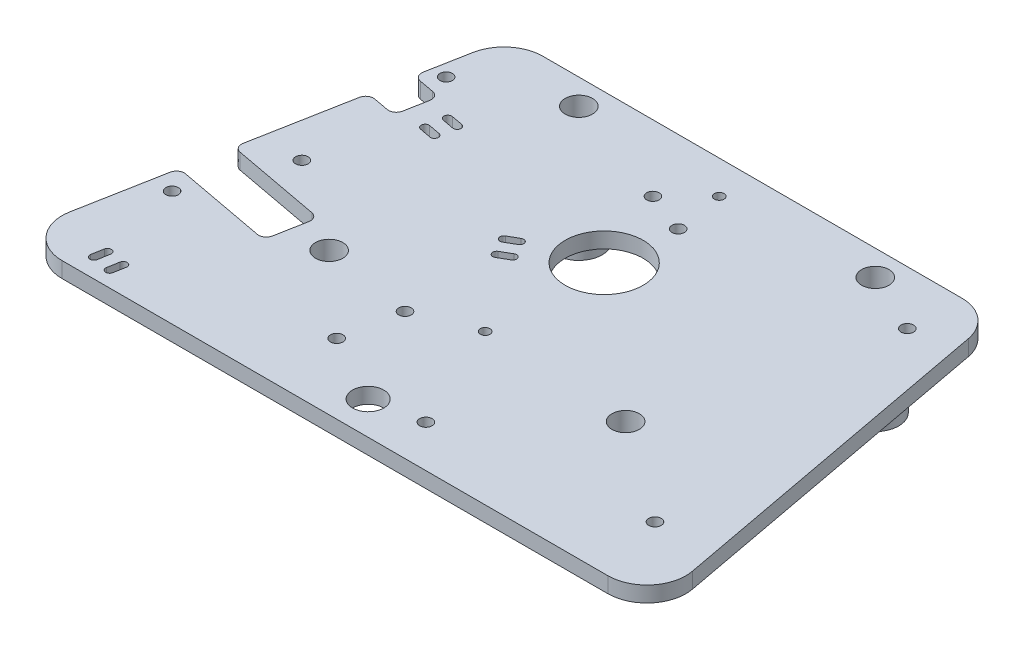
from build123d import *

# Parameters (mm, degrees)
ESQUISSE1_W              = 124
ESQUISSE1_H              = 107
BOSS_EXTRU_1_DEPTH       = 4
ESQUISSE3_R              = 6
BOSS_EXTRU_4_DEPTH       = 26
ENL_V_MAT_EXTRU_2_REACH  = 89.214
ESQUISSE4_R              = 10
BOSS_EXTRU_5_DEPTH       = 4
ESQUISSE2_R              = 1.6
ENL_V_MAT_EXTRU_1_DEPTH  = 103.40239255
ESQUISSE6_R              = 1.6
ENL_V_MAT_EXTRU_3_DEPTH  = 103.40239255
CONG_1_R                 = 10
ESQUISSE7_R              = 3.5
ENL_V_MAT_EXTRU_4_DEPTH  = 27
ESQUISSE8_R              = 1.7
ENL_V_MAT_EXTRU_5_DEPTH  = 101.774383085
ENL_V_MAT_EXTRU_6_REACH  = 101.657
CONG_2_R                 = 2
ESQUISSE10_R             = 3.5
BOSS_EXTRU_6_DEPTH       = 5
ENL_V_MAT_EXTRU_8_REACH  = 102.774
ESQUISSE11_R             = 1.25
ENL_V_MAT_EXTRU_9_REACH  = 102.774
ESQUISSE12_R             = 4
ENL_V_MAT_EXTRU_10_REACH = 102.774
CONG_3_R                 = 2
ENL_V_MAT_EXTRU_11_REACH = 102.774
ENL_V_MAT_EXTRU_12_REACH = 102.774
ENL_V_MAT_EXTRU_13_REACH = 102.774
ESQUISSE16_R             = 1.6
ENL_V_MAT_EXTRU_14_REACH = 102.774


with BuildPart() as part:
    # Esquisse1 → Boss.-Extru.1 (new body)
    with BuildSketch(Plane(origin=(0, 0, 0), x_dir=(1, 0, 0), z_dir=(0, 1, 0))):
        Rectangle(ESQUISSE1_W, ESQUISSE1_H)
    extrude(amount=BOSS_EXTRU_1_DEPTH)

    # Esquisse3 → Boss.-Extru.4 (add)
    with BuildSketch(Plane(origin=(0, 0, 0), x_dir=(1, 0, 0), z_dir=(0, 1, 0))):
        with Locations(Location((-38, -17, 0), (0, 0, 270))):
            Circle(ESQUISSE3_R)
        with Locations(Location((38, -17, 0), (0, 0, 270))):
            Circle(ESQUISSE3_R)
        with Locations(Location((38, 47, 0), (0, 0, 270))):
            Circle(ESQUISSE3_R)
        with Locations(Location((-38, 47, 0), (0, 0, 270))):
            Circle(ESQUISSE3_R)
    extrude(amount=-BOSS_EXTRU_4_DEPTH)

    # Esquisse4 → Enlèv. mat.-Extru.2 (cut, up to next)
    with BuildSketch(Plane(origin=(0, 4, 0), x_dir=(1, 0, 0), z_dir=(0, 1, 0)), mode=Mode.PRIVATE) as enl_v_mat_extru_2_sk1:
        with Locations(Location((0, 15.5, 0), (0, 0, 270))):
            Circle(ESQUISSE4_R)
    enl_v_mat_extru_2_tool1 = extrude(enl_v_mat_extru_2_sk1.sketch, amount=-ENL_V_MAT_EXTRU_2_REACH, mode=Mode.PRIVATE) & part.part
    add(enl_v_mat_extru_2_tool1.solids().sort_by_distance((0, 4, -15.5))[0], mode=Mode.SUBTRACT)

    # Esquisse5 → Boss.-Extru.5 (add)
    with BuildSketch(Plane(origin=(0, 4, 0), x_dir=(1, 0, 0), z_dir=(0, 1, 0))):
        Polygon((-62, 53.5), (-82, -53.5), (-62, -53.5), align=None)
    boss_extru_5 = extrude(amount=-BOSS_EXTRU_5_DEPTH)

    # Esquisse2 → Enlèv. mat.-Extru.1 (cut, through all)
    with BuildSketch(Plane(origin=(0, 4, 0), x_dir=(1, 0, 0), z_dir=(0, 1, 0))):
        with Locations(Location((-61.5, 36.5, 0), (0, 0, 270))):
            Circle(ESQUISSE2_R)
        with Locations(Location((-8.5, 36.5, 0), (0, 0, 270))):
            Circle(ESQUISSE2_R)
        with Locations(Location((-61.5, -0.5, 0), (0, 0, 270))):
            Circle(ESQUISSE2_R)
    extrude(amount=-ENL_V_MAT_EXTRU_1_DEPTH, mode=Mode.SUBTRACT)

    # Symétrie1: Boss.-Extru.5 across plane
    add(boss_extru_5.mirror(Plane(origin=(0, 0, 0), x_dir=(0, 0, 1), z_dir=(1, 0, 0))))

    # Esquisse6 → Enlèv. mat.-Extru.3 (cut, through all)
    with BuildSketch(Plane(origin=(0, 4, 0), x_dir=(1, 0, 0), z_dir=(0, 1, 0))):
        with Locations(Location((53.458391951, 39.748687237, 0), (0, 0, 270))):
            Circle(ESQUISSE6_R)
        with Locations(Location((1.964452376, 32.511685987, 0), (0, 0, 270))):
            Circle(ESQUISSE6_R)
        with Locations(Location((12.541608049, -42.748687237, 0), (0, 0, 270))):
            Circle(ESQUISSE6_R)
        with Locations(Location((64.035547624, -35.511685987, 0), (0, 0, 270))):
            Circle(ESQUISSE6_R)
    extrude(amount=-ENL_V_MAT_EXTRU_3_DEPTH, mode=Mode.SUBTRACT)

    # Congé1
    cong_1_edges = [part.edges().sort_by_distance(p)[0] for p in [
        (-82, 2, 53.5),
        (82, 2, 53.5),
        (-62, 2, -53.5),
        (62, 2, -53.5),
    ]]
    fillet(cong_1_edges, radius=CONG_1_R)

    # Esquisse7 → Enlèv. mat.-Extru.4 (cut)
    with BuildSketch(Plane(origin=(0, 4, 0), x_dir=(1, 0, 0), z_dir=(0, 1, 0))):
        with Locations(Location((-38, 47, 0), (0, 0, 270))):
            Circle(ESQUISSE7_R)
        with Locations(Location((38, 47, 0), (0, 0, 270))):
            Circle(ESQUISSE7_R)
        with Locations(Location((-38, -17, 0), (0, 0, 270))):
            Circle(ESQUISSE7_R)
        with Locations(Location((38, -17, 0), (0, 0, 270))):
            Circle(ESQUISSE7_R)
    extrude(amount=-ENL_V_MAT_EXTRU_4_DEPTH, mode=Mode.SUBTRACT)

    # Esquisse8 → Enlèv. mat.-Extru.5 (cut, through all)
    with BuildSketch(Plane.XZ.offset(26)):
        with Locations(Location((-38, -47, 0), (0, 0, 270))):
            Circle(ESQUISSE8_R)
        with Locations(Location((-38, 17, 0), (0, 0, 270))):
            Circle(ESQUISSE8_R)
        with Locations(Location((38, 17, 0), (0, 0, 270))):
            Circle(ESQUISSE8_R)
        with Locations(Location((38, -47, 0), (0, 0, 270))):
            Circle(ESQUISSE8_R)
    extrude(amount=-ENL_V_MAT_EXTRU_5_DEPTH, mode=Mode.SUBTRACT)

    # Esquisse9 → Enlèv. mat.-Extru.6 (cut, up to next)
    with BuildSketch(Plane.XZ, mode=Mode.PRIVATE) as enl_v_mat_extru_6_sk1:
        Polygon((-48.832226611, 23.004113615), (-75.37257944, 18.043300002), (-73.167773389, 6.247587634), (-46.62742056, 11.208401247), align=None)
    enl_v_mat_extru_6_tool1 = extrude(enl_v_mat_extru_6_sk1.sketch, amount=-ENL_V_MAT_EXTRU_6_REACH, mode=Mode.PRIVATE) & part.part
    add(enl_v_mat_extru_6_tool1.solids().sort_by_distance((-61, 0, 14.625851))[0], mode=Mode.SUBTRACT)

    # Congé2
    cong_2_edges = [part.edges().sort_by_distance(p)[0] for p in [
        (-48.832226611, 2, 23.004113615),
        (-46.62742056, 2, 11.208401247),
        (-73.167773389, 2, 6.247587634),
        (-75.37257944, 2, 18.043300002),
    ]]
    fillet(cong_2_edges, radius=CONG_2_R)

    # Esquisse10 → Boss.-Extru.6 (add)
    with BuildSketch(Plane(origin=(0, 0, 0), x_dir=(1, 0, 0), z_dir=(0, 1, 0))):
        with Locations(Location((0, 45, 0), (0, 0, 270))):
            Circle(ESQUISSE10_R)
        with Locations(Location((0, -15, 0), (0, 0, 270))):
            Circle(ESQUISSE10_R)
    extrude(amount=-BOSS_EXTRU_6_DEPTH)

    # Esquisse11 → Enlèv. mat.-Extru.8 (cut, up to next)
    with BuildSketch(Plane(origin=(0, 4, 0), x_dir=(1, 0, 0), z_dir=(0, 1, 0)), mode=Mode.PRIVATE) as enl_v_mat_extru_8_sk1:
        with Locations(Location((0, 45, 0), (0, 0, 270))):
            Circle(ESQUISSE11_R)
    enl_v_mat_extru_8_tool1 = extrude(enl_v_mat_extru_8_sk1.sketch, amount=-ENL_V_MAT_EXTRU_8_REACH, mode=Mode.PRIVATE) & part.part
    # Esquisse11 → Enlèv. mat.-Extru.8 (cut, up to next)
    with BuildSketch(Plane(origin=(0, 4, 0), x_dir=(1, 0, 0), z_dir=(0, 1, 0)), mode=Mode.PRIVATE) as enl_v_mat_extru_8_sk2:
        with Locations(Location((0, -15, 0), (0, 0, 270))):
            Circle(ESQUISSE11_R)
    enl_v_mat_extru_8_tool2 = extrude(enl_v_mat_extru_8_sk2.sketch, amount=-ENL_V_MAT_EXTRU_8_REACH, mode=Mode.PRIVATE) & part.part
    add(enl_v_mat_extru_8_tool1.solids().sort_by_distance((0, 4, -45))[0], mode=Mode.SUBTRACT)
    add(enl_v_mat_extru_8_tool2.solids().sort_by_distance((0, 4, 15))[0], mode=Mode.SUBTRACT)

    # Esquisse12 → Enlèv. mat.-Extru.9 (cut, up to next)
    with BuildSketch(Plane(origin=(0, 4, 0), x_dir=(1, 0, 0), z_dir=(0, 1, 0)), mode=Mode.PRIVATE) as enl_v_mat_extru_9_sk1:
        with Locations(Location((0, -45, 0), (0, 0, 270))):
            Circle(ESQUISSE12_R)
    enl_v_mat_extru_9_tool1 = extrude(enl_v_mat_extru_9_sk1.sketch, amount=-ENL_V_MAT_EXTRU_9_REACH, mode=Mode.PRIVATE) & part.part
    add(enl_v_mat_extru_9_tool1.solids().sort_by_distance((0, 4, 45))[0], mode=Mode.SUBTRACT)

    # Esquisse13 → Enlèv. mat.-Extru.10 (cut, up to next)
    with BuildSketch(Plane(origin=(0, 4, 0), x_dir=(1, 0, 0), z_dir=(0, 1, 0)), mode=Mode.PRIVATE) as enl_v_mat_extru_10_sk1:
        Polygon((-59.870760876, 21.350184496), (-67.734569122, 22.820055197), (-65.897230747, 32.649815504), (-58.033422501, 31.179944803), align=None)
    enl_v_mat_extru_10_tool1 = extrude(enl_v_mat_extru_10_sk1.sketch, amount=-ENL_V_MAT_EXTRU_10_REACH, mode=Mode.PRIVATE) & part.part
    add(enl_v_mat_extru_10_tool1.solids().sort_by_distance((-62.883996, 4, -27))[0], mode=Mode.SUBTRACT)

    # Congé3
    cong_3_edges = [part.edges().sort_by_distance(p)[0] for p in [
        (-58.033422501, 2, -31.179944803),
        (-59.870760876, 2, -21.350184496),
        (-67.734569122, 2, -22.820055197),
        (-65.897230747, 2, -32.649815504),
    ]]
    fillet(cong_3_edges, radius=CONG_3_R)

    # Esquisse14 → Enlèv. mat.-Extru.11 (cut, up to next)
    with BuildSketch(Plane(origin=(0, 4, 0), x_dir=(1, 0, 0), z_dir=(0, 1, 0)), mode=Mode.PRIVATE) as enl_v_mat_extru_11_sk1:
        with BuildLine():
            Line((-49.338218641, 25.99405724), (-52.287146733, 26.545258752))
            ThreePointArc((-52.287146733, 26.545258752), (-53.086388926, 27.71196862), (-51.919679058, 28.511210814))
            Line((-51.919679058, 28.511210814), (-48.970750966, 27.960009301))
            ThreePointArc((-48.970750966, 27.960009301), (-48.171508773, 26.793299433), (-49.338218641, 25.99405724))
        make_face()
    enl_v_mat_extru_11_tool1 = extrude(enl_v_mat_extru_11_sk1.sketch, amount=-ENL_V_MAT_EXTRU_11_REACH, mode=Mode.PRIVATE) & part.part
    # Esquisse14 → Enlèv. mat.-Extru.11 (cut, up to next)
    with BuildSketch(Plane(origin=(0, 4, 0), x_dir=(1, 0, 0), z_dir=(0, 1, 0)), mode=Mode.PRIVATE) as enl_v_mat_extru_11_sk2:
        with BuildLine():
            Line((-50.256887828, 21.079177086), (-53.205815921, 21.630378599))
            ThreePointArc((-53.205815921, 21.630378599), (-54.005058114, 22.797088467), (-52.838348246, 23.59633066))
            Line((-52.838348246, 23.59633066), (-49.889420153, 23.045129147))
            ThreePointArc((-49.889420153, 23.045129147), (-49.09017796, 21.878419279), (-50.256887828, 21.079177086))
        make_face()
    enl_v_mat_extru_11_tool2 = extrude(enl_v_mat_extru_11_sk2.sketch, amount=-ENL_V_MAT_EXTRU_11_REACH, mode=Mode.PRIVATE) & part.part
    add(enl_v_mat_extru_11_tool1.solids().sort_by_distance((-50.628949, 4, -27.252634))[0], mode=Mode.SUBTRACT)
    add(enl_v_mat_extru_11_tool2.solids().sort_by_distance((-51.547618, 4, -22.337754))[0], mode=Mode.SUBTRACT)

    # Esquisse15 → Enlèv. mat.-Extru.12 (cut, up to next)
    with BuildSketch(Plane(origin=(0, 4, 0), x_dir=(1, 0, 0), z_dir=(0, 1, 0)), mode=Mode.PRIVATE) as enl_v_mat_extru_12_sk1:
        with BuildLine():
            Line((-18.637495374, 8.781088913), (-16.039419162, 10.281088913))
            ThreePointArc((-16.039419162, 10.281088913), (-14.673393759, 9.915063509), (-15.039419162, 8.549038106))
            Line((-15.039419162, 8.549038106), (-17.637495374, 7.049038106))
            ThreePointArc((-17.637495374, 7.049038106), (-19.003520778, 7.415063509), (-18.637495374, 8.781088913))
        make_face()
    enl_v_mat_extru_12_tool1 = extrude(enl_v_mat_extru_12_sk1.sketch, amount=-ENL_V_MAT_EXTRU_12_REACH, mode=Mode.PRIVATE) & part.part
    # Esquisse15 → Enlèv. mat.-Extru.12 (cut, up to next)
    with BuildSketch(Plane(origin=(0, 4, 0), x_dir=(1, 0, 0), z_dir=(0, 1, 0)), mode=Mode.PRIVATE) as enl_v_mat_extru_12_sk2:
        with BuildLine():
            Line((-16.137495374, 4.450961894), (-13.539419162, 5.950961894))
            ThreePointArc((-13.539419162, 5.950961894), (-12.173393759, 5.584936491), (-12.539419162, 4.218911087))
            Line((-12.539419162, 4.218911087), (-15.137495374, 2.718911087))
            ThreePointArc((-15.137495374, 2.718911087), (-16.503520778, 3.084936491), (-16.137495374, 4.450961894))
        make_face()
    enl_v_mat_extru_12_tool2 = extrude(enl_v_mat_extru_12_sk2.sketch, amount=-ENL_V_MAT_EXTRU_12_REACH, mode=Mode.PRIVATE) & part.part
    add(enl_v_mat_extru_12_tool1.solids().sort_by_distance((-16.838457, 4, -8.665064))[0], mode=Mode.SUBTRACT)
    add(enl_v_mat_extru_12_tool2.solids().sort_by_distance((-14.338457, 4, -4.334936))[0], mode=Mode.SUBTRACT)

    # Esquisse16 → Enlèv. mat.-Extru.13 (cut, up to next)
    with BuildSketch(Plane(origin=(0, 4, 0), x_dir=(1, 0, 0), z_dir=(0, 1, 0)), mode=Mode.PRIVATE) as enl_v_mat_extru_13_sk1:
        with Locations(Location((-14.74, -20.82, 0), (0, 0, 270))):
            Circle(ESQUISSE16_R)
    enl_v_mat_extru_13_tool1 = extrude(enl_v_mat_extru_13_sk1.sketch, amount=-ENL_V_MAT_EXTRU_13_REACH, mode=Mode.PRIVATE) & part.part
    # Esquisse16 → Enlèv. mat.-Extru.13 (cut, up to next)
    with BuildSketch(Plane(origin=(0, 4, 0), x_dir=(1, 0, 0), z_dir=(0, 1, 0)), mode=Mode.PRIVATE) as enl_v_mat_extru_13_sk2:
        with Locations(Location((-17.496696898, -35.564511596, 0), (0, 0, 270))):
            Circle(ESQUISSE16_R)
    enl_v_mat_extru_13_tool2 = extrude(enl_v_mat_extru_13_sk2.sketch, amount=-ENL_V_MAT_EXTRU_13_REACH, mode=Mode.PRIVATE) & part.part
    # Esquisse16 → Enlèv. mat.-Extru.13 (cut, up to next)
    with BuildSketch(Plane(origin=(0, 4, 0), x_dir=(1, 0, 0), z_dir=(0, 1, 0)), mode=Mode.PRIVATE) as enl_v_mat_extru_13_sk3:
        with Locations(Location((-71.284236395, -23.982171809, 0), (0, 0, 270))):
            Circle(ESQUISSE16_R)
    enl_v_mat_extru_13_tool3 = extrude(enl_v_mat_extru_13_sk3.sketch, amount=-ENL_V_MAT_EXTRU_13_REACH, mode=Mode.PRIVATE) & part.part
    add(enl_v_mat_extru_13_tool1.solids().sort_by_distance((-14.74, 4, 20.82))[0], mode=Mode.SUBTRACT)
    add(enl_v_mat_extru_13_tool2.solids().sort_by_distance((-17.496697, 4, 35.564512))[0], mode=Mode.SUBTRACT)
    add(enl_v_mat_extru_13_tool3.solids().sort_by_distance((-71.284236, 4, 23.982172))[0], mode=Mode.SUBTRACT)

    # Esquisse17 → Enlèv. mat.-Extru.14 (cut, up to next)
    with BuildSketch(Plane(origin=(0, 4, 0), x_dir=(1, 0, 0), z_dir=(0, 1, 0)), mode=Mode.PRIVATE) as enl_v_mat_extru_14_sk1:
        with BuildLine():
            Line((-67.665410336, -48.46059649), (-67.144465803, -45.506173231))
            ThreePointArc((-67.144465803, -45.506173231), (-65.986009872, -44.695013655), (-65.174850297, -45.853469586))
            Line((-65.174850297, -45.853469586), (-65.69579483, -48.807892845))
            ThreePointArc((-65.69579483, -48.807892845), (-66.854250761, -49.61905242), (-67.665410336, -48.46059649))
        make_face()
    enl_v_mat_extru_14_tool1 = extrude(enl_v_mat_extru_14_sk1.sketch, amount=-ENL_V_MAT_EXTRU_14_REACH, mode=Mode.PRIVATE) & part.part
    # Esquisse17 → Enlèv. mat.-Extru.14 (cut, up to next)
    with BuildSketch(Plane(origin=(0, 4, 0), x_dir=(1, 0, 0), z_dir=(0, 1, 0)), mode=Mode.PRIVATE) as enl_v_mat_extru_14_sk2:
        with BuildLine():
            Line((-60.250811532, -46.721710474), (-60.771756065, -49.676133733))
            ThreePointArc((-60.771756065, -49.676133733), (-61.930211996, -50.487293309), (-62.741371571, -49.328837378))
            Line((-62.741371571, -49.328837378), (-62.220427038, -46.374414119))
            ThreePointArc((-62.220427038, -46.374414119), (-61.061971107, -45.563254544), (-60.250811532, -46.721710474))
        make_face()
    enl_v_mat_extru_14_tool2 = extrude(enl_v_mat_extru_14_sk2.sketch, amount=-ENL_V_MAT_EXTRU_14_REACH, mode=Mode.PRIVATE) & part.part
    add(enl_v_mat_extru_14_tool1.solids().sort_by_distance((-66.42013, 4, 47.157033))[0], mode=Mode.SUBTRACT)
    add(enl_v_mat_extru_14_tool2.solids().sort_by_distance((-61.496092, 4, 48.025274))[0], mode=Mode.SUBTRACT)


solid = part.part
